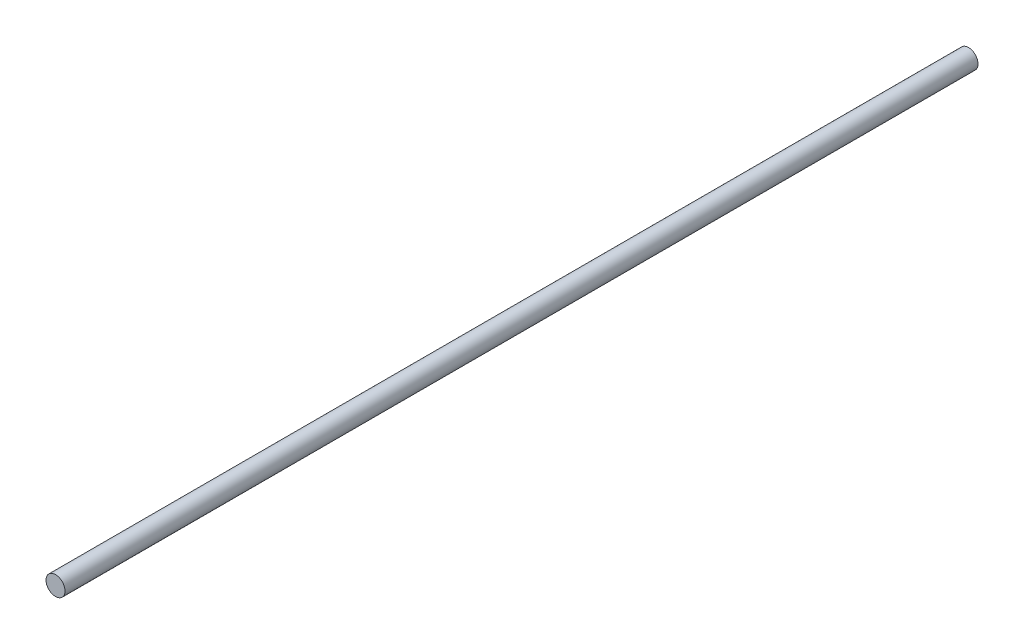
from build123d import *

# Parameters (mm, degrees)
SKETCH1_R           = 3.175
BOSS_EXTRUDE1_DEPTH = 304.8


with BuildPart() as part:
    # Sketch1 → Boss-Extrude1 (new body)
    with BuildSketch(Plane.XY):
        with Locations(Location((0, 0, 0), (0, 0, 180))):
            Circle(SKETCH1_R)
    extrude(amount=BOSS_EXTRUDE1_DEPTH)


solid = part.part
